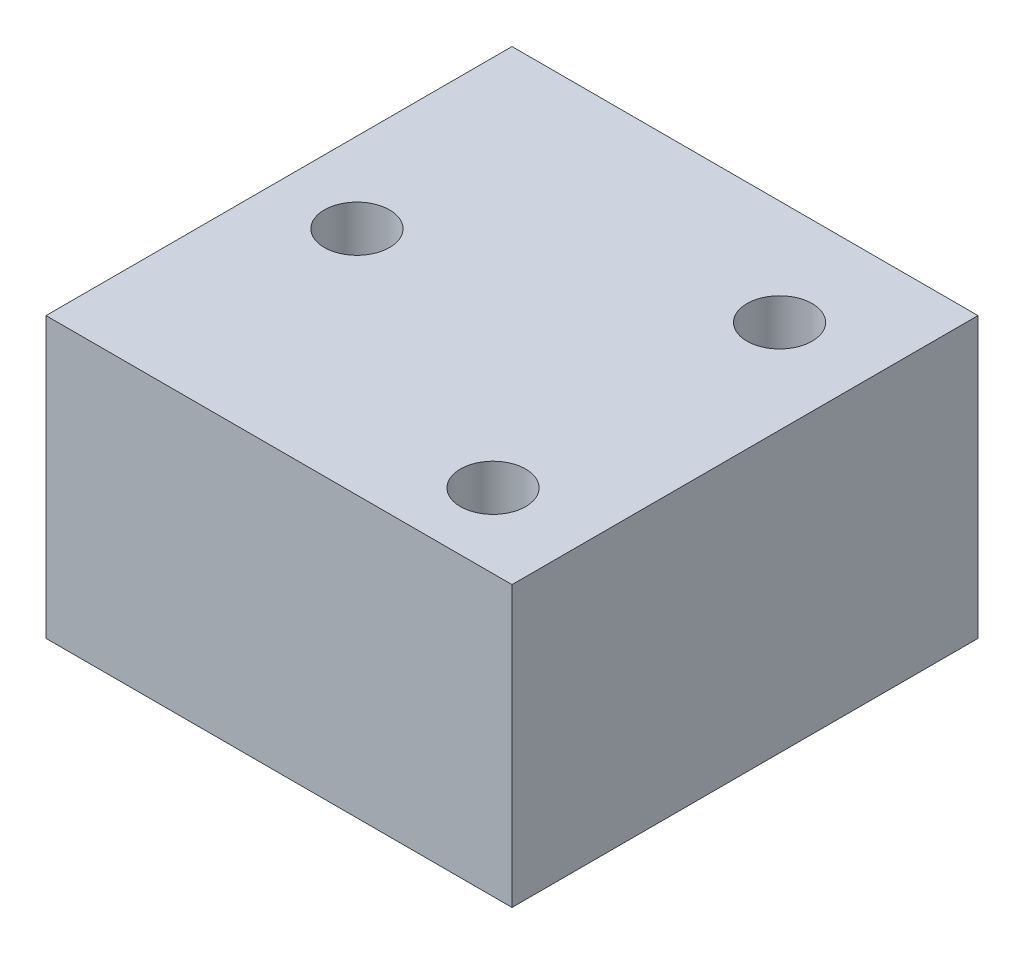
from build123d import *

# Parameters (mm, degrees)
SKETCH1_W           = 50
SKETCH1_H           = 50
BOSS_EXTRUDE1_DEPTH = 30
SKETCH2_R           = 3.5
CUT_EXTRUDE1_DEPTH  = 10


with BuildPart() as part:
    # Sketch1 → Boss-Extrude1 (new body)
    with BuildSketch(Plane(origin=(0, 0, 0), x_dir=(1, 0, 0), z_dir=(0, 1, 0))):
        with Locations((25, 25)):
            Rectangle(SKETCH1_W, SKETCH1_H)
    extrude(amount=BOSS_EXTRUDE1_DEPTH)

    # Sketch2 → Cut-Extrude1 (cut)
    with BuildSketch(Plane(origin=(0, 30, 0), x_dir=(1, 0, 0), z_dir=(0, 1, 0))):
        with Locations(Location((39.986355358, 38.722868724, 0), (0, 0, 270))):
            Circle(SKETCH2_R)
        with Locations(Location((39.986355358, 7.978027286, 0), (0, 0, 270))):
            Circle(SKETCH2_R)
        with Locations(Location((8.609770604, 24.754322043, 0), (0, 0, 270))):
            Circle(SKETCH2_R)
    extrude(amount=-CUT_EXTRUDE1_DEPTH, mode=Mode.SUBTRACT)


solid = part.part
